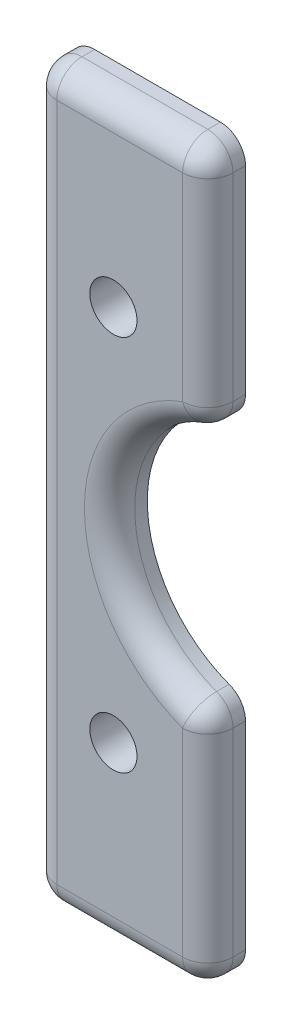
from build123d import *

# Parameters (mm, degrees)
SKETCH1_R           = 1.875
BOSS_EXTRUDE1_DEPTH = 3
FILLET1_R           = 2
SKETCH2_R           = 3.75
BOSS_EXTRUDE2_DEPTH = 4


with BuildPart() as part:
    # Sketch1 → Boss-Extrude1 (new body)
    with BuildSketch(Plane.XY):
        with BuildLine():
            Line((-20.997727651, -1.013441276), (-30.997581376, -1.013441276))
            ThreePointArc((-30.997581376, -1.013441276), (-32.411794939, -1.599227714), (-32.997581376, -3.013441276))
            Line((-32.997581376, -3.013441276), (-32.997581376, -57.013441276))
            ThreePointArc((-32.997581376, -57.013441276), (-32.411794939, -58.427654839), (-30.997581376, -59.013441276))
            Line((-30.997581376, -59.013441276), (-20.997727651, -59.013441276))
            ThreePointArc((-20.997727651, -59.013441276), (-19.583514088, -58.427654839), (-18.997727651, -57.013441276))
            Line((-18.997727651, -57.013441276), (-18.997727651, -41.251974862))
            ThreePointArc((-18.997727651, -41.251974862), (-19.354888824, -40.111325665), (-20.298808241, -39.378072073))
            ThreePointArc((-20.298808241, -39.378072073), (-26.804211193, -30.008558133), (-20.298808241, -20.639044193))
            ThreePointArc((-20.298808241, -20.639044193), (-19.354888824, -19.905790602), (-18.997727651, -18.765141405))
            Line((-18.997727651, -18.765141405), (-18.997727651, -3.013441276))
            ThreePointArc((-18.997727651, -3.013441276), (-19.583514088, -1.599227714), (-20.997727651, -1.013441276))
        make_face()
        with Locations((-26.501848256, -15.008558747)):
            Circle(SKETCH1_R, mode=Mode.SUBTRACT)
        with Locations((-26.501848256, -45.008558747)):
            Circle(SKETCH1_R, mode=Mode.SUBTRACT)
    extrude(amount=BOSS_EXTRUDE1_DEPTH)

    # Fillet1
    fillet1_edges = [part.edges().sort_by_distance(p)[0] for p in [
        (-19.354888824, -40.111325665, 3),
        (-26.804211193, -30.008558133, 3),
        (-19.354888824, -19.905790602, 3),
        (-18.997727651, -10.889291341, 3),
        (-19.583514088, -1.599227714, 3),
        (-25.997654514, -1.013441276, 3),
        (-32.411794939, -1.599227714, 3),
        (-32.997581376, -30.013441276, 3),
        (-32.411794939, -58.427654839, 3),
        (-25.997654514, -59.013441276, 3),
        (-19.583514088, -58.427654839, 3),
        (-18.997727651, -49.132708069, 3),
    ]]
    fillet(fillet1_edges, radius=FILLET1_R)

    # Sketch2 → Boss-Extrude2 (add)
    with BuildSketch(Plane.XY.offset(3)):
        with Locations((-26.501848256, -7.508558747)):
            Circle(SKETCH2_R)
        with Locations((-26.501848256, -52.508558747)):
            Circle(SKETCH2_R)
    extrude(amount=-BOSS_EXTRUDE2_DEPTH)


solid = part.part
